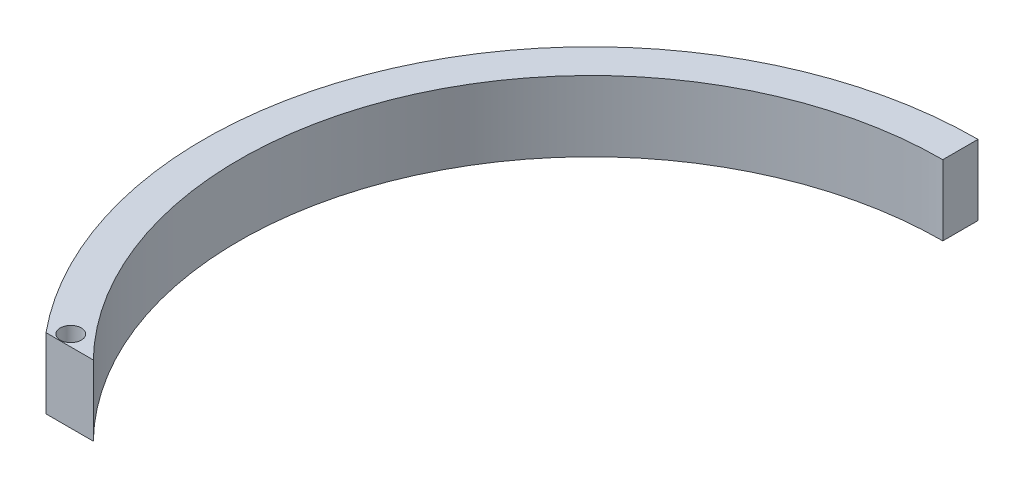
from build123d import *

# Parameters (mm, degrees)
SKETCH2_R           = 1.5
BOSS_EXTRUDE1_DEPTH = 10


with BuildPart() as part:
    # Sketch2 → Boss-Extrude1 (new body)
    with BuildSketch(Plane(origin=(0, 0, 0), x_dir=(1, 0, 0), z_dir=(0, 1, 0))):
        with BuildLine():
            Line((0, 55), (0, 50))
            ThreePointArc((0, 50), (-46.097722286, 19.364916731), (-35.707142143, -35))
            Line((-35.707142143, -35), (-42.426406871, -35))
            ThreePointArc((-42.426406871, -35), (-49.749371855, 23.452078799), (0, 55))
        make_face()
        with Locations(Location((-40.497933832, -33.409090909, 0), (0, 0, 270))):
            Circle(SKETCH2_R, mode=Mode.SUBTRACT)
    extrude(amount=BOSS_EXTRUDE1_DEPTH)


solid = part.part
